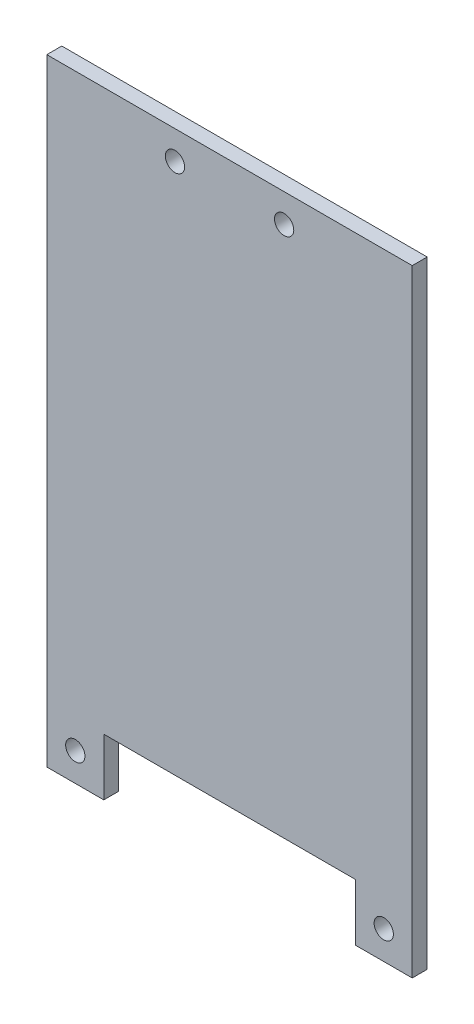
from build123d import *

# Parameters (mm, degrees)
BOSS_EXTRUDE1_DEPTH = 1.5748
SKETCH4_R           = 1.016
CUT_EXTRUDE1_DEPTH  = 78.133316539


with BuildPart() as part:
    # Model → Boss-Extrude1 (new body)
    with BuildSketch(Plane.XY):
        Polygon((6.10108, 7.76224), (32.6009, 7.76224), (32.6009, 1.76276), (38.60038, 1.76276), (38.60038, 66.76136), (0.1016, 66.76136), (0.1016, 1.76276), (6.10108, 1.76276), align=None)
    extrude(amount=BOSS_EXTRUDE1_DEPTH)

    # Sketch4 → Cut-Extrude1 (cut, through all)
    with BuildSketch(Plane.XY.offset(1.5748)):
        with Locations((13.6017, 63.76162)):
            Circle(SKETCH4_R)
        with Locations((25.10282, 63.76162)):
            Circle(SKETCH4_R)
        with Locations((3.10134, 4.7625)):
            Circle(SKETCH4_R)
        with Locations((35.60064, 4.7625)):
            Circle(SKETCH4_R)
    extrude(amount=-CUT_EXTRUDE1_DEPTH, mode=Mode.SUBTRACT)


solid = part.part
